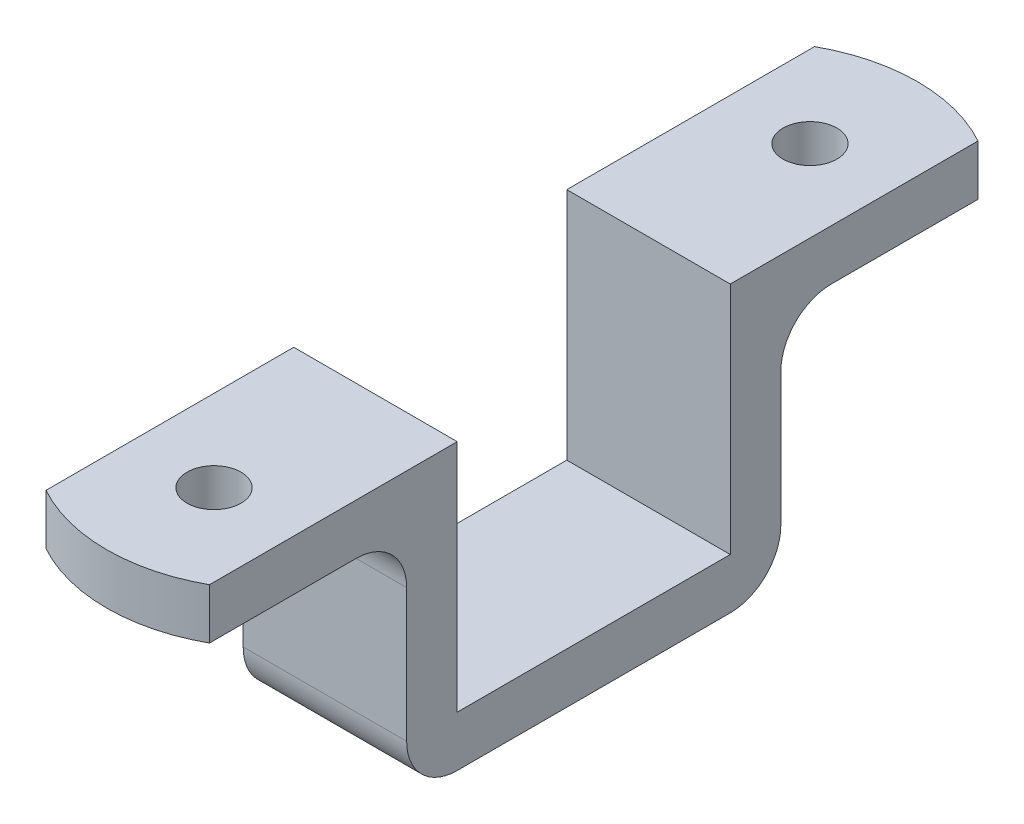
from build123d import *

# Parameters (mm, degrees)
BOSS_EXTRUDE1_DEPTH = 9.7
FILLET3_R           = 3
SKETCH2_R           = 1.6
CUT_EXTRUDE1_DEPTH  = 9.7
CUT_EXTRUDE2_DEPTH  = 9.7


with BuildPart() as part:
    # Sketch1 → Boss-Extrude1 (new body)
    with BuildSketch(Plane(origin=(0, 0, 0), x_dir=(0, 0, -1), z_dir=(1, 0, 0))):
        Polygon((0, 0), (-16.9, 0), (-16.9, -13.9), (-33.1, -13.9), (-33.1, 0), (-50, 0), (-50, -3), (-36.1, -3), (-36.1, -16.9), (-13.9, -16.9), (-13.9, -3), (0, -3), align=None)
    extrude(amount=BOSS_EXTRUDE1_DEPTH)

    # Fillet3
    fillet3_edges = [part.edges().sort_by_distance(p)[0] for p in [
        (4.85, -3, 13.9),
        (4.85, -16.9, 13.9),
        (4.85, -16.9, 36.1),
        (4.85, -3, 36.1),
    ]]
    fillet(fillet3_edges, radius=FILLET3_R)

    # Sketch2 → Cut-Extrude1 (cut)
    with BuildSketch(Plane.XZ.offset(3)):
        with Locations(Location((4.85, 42.68, 0), (0, 0, 270))):
            Circle(SKETCH2_R)
        with Locations(Location((4.85, 7.32, 0), (0, 0, 270))):
            Circle(SKETCH2_R)
    extrude(amount=-CUT_EXTRUDE1_DEPTH, mode=Mode.SUBTRACT)

    # Sketch3 → Cut-Extrude2 (cut)
    with BuildSketch(Plane.XZ.offset(3)):
        with BuildLine():
            Line((0, 0), (9.7, 0))
            Line((9.7, 0), (9.7, 2.2))
            ThreePointArc((9.7, 2.2), (4.85, 0.945141508), (0, 2.2))
            Line((0, 2.2), (0, 0))
        make_face()
        with BuildLine():
            Line((0, 47.8), (0, 50))
            Line((0, 50), (9.7, 50))
            Line((9.7, 50), (9.7, 47.8))
            ThreePointArc((9.7, 47.8), (4.85, 49.054858492), (0, 47.8))
        make_face()
    extrude(amount=-CUT_EXTRUDE2_DEPTH, mode=Mode.SUBTRACT)


solid = part.part
